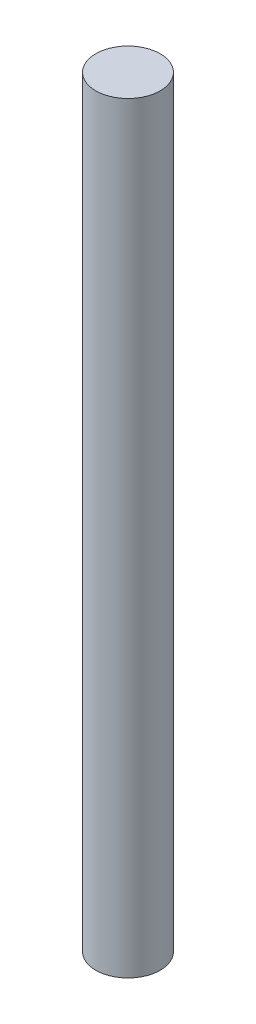
from build123d import *

# Parameters (mm, degrees)
SKETCH2_R           = 1.985
BOSS_EXTRUDE1_DEPTH = 47


with BuildPart() as part:
    # Sketch2 → Boss-Extrude1 (new body)
    with BuildSketch(Plane(origin=(0, 0, 0), x_dir=(1, 0, 0), z_dir=(0, 1, 0))):
        with Locations(Location((0, 0, 0), (0, 0, 270))):
            Circle(SKETCH2_R)
    extrude(amount=BOSS_EXTRUDE1_DEPTH)


solid = part.part
